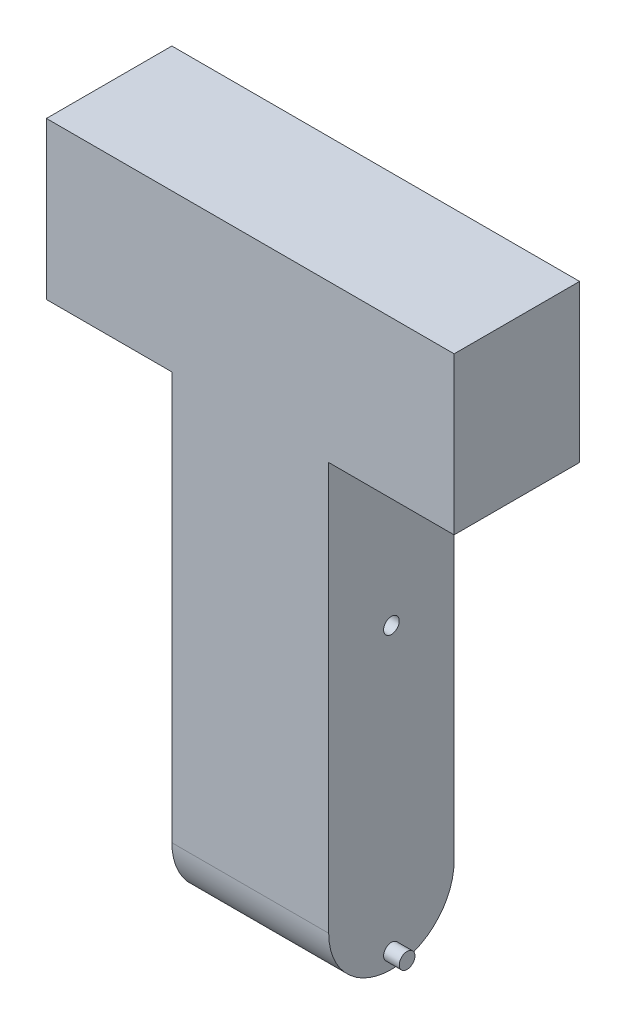
from build123d import *

# Parameters (mm, degrees)
SKETCH1_W                       = 254
SKETCH1_H                       = 1016
BOSS_EXTRUDE1_DEPTH             = 203.2
FILLET1_RADIUS                  = 101.6
FILLET1_LENGTH                  = 254
BOSS_EXTRUDE2_DEPTH             = 25.4
BOSS_EXTRUDE2_DEPTH_BACK        = 279.4
SKETCH2_R                       = 12.7
CUT_EXTRUDE1_DEPTH              = 195.834
CUT_EXTRUDE1_DEPTH_BACK         = 440.182
SKETCH4_R                       = 12.7
BOSS_EXTRUDE3_REACH             = 1060.604
SKETCH5_W                       = 660.4
SKETCH5_H                       = 254
BOSS_EXTRUDE3_DIRECTION_2_REACH = 1060.604


with BuildPart() as part:
    # Sketch1 → Boss-Extrude1 (new body)
    with BuildSketch(Plane.XY):
        with Locations((127, 508)):
            Rectangle(SKETCH1_W, SKETCH1_H)
    extrude(amount=BOSS_EXTRUDE1_DEPTH)

    # Fillet1: full round fillet: the end face becomes a half cylinder, R = half its width
    fillet1_face = Plane((127, 0, 101.6), x_dir=(1, 0, 0), z_dir=(0, -1, 0))  # on the end face: x along it, z out of the body
    fillet1_slab = fillet1_face.offset(-FILLET1_RADIUS / 2) * Box(FILLET1_LENGTH, 2 * FILLET1_RADIUS, FILLET1_RADIUS, mode=Mode.PRIVATE)  # the body's end, R deep
    fillet1_round = Plane((127, 101.6, 101.6), x_dir=(0, -1, 0), z_dir=(1, 0, 0)) * Cylinder(FILLET1_RADIUS, FILLET1_LENGTH, mode=Mode.PRIVATE)  # its axis R under the face
    add(fillet1_slab - fillet1_round, mode=Mode.SUBTRACT)

    # Sketch2 → Boss-Extrude2 (add, two sides: drawn at the far end of the back side and taken through both)
    with BuildSketch(Plane(origin=(254, 0, 0), x_dir=(0, 0, -1), z_dir=(1, 0, 0)).offset(-BOSS_EXTRUDE2_DEPTH_BACK)):
        with Locations((-101.6, 25.4)):
            Circle(SKETCH2_R)
    extrude(amount=BOSS_EXTRUDE2_DEPTH + BOSS_EXTRUDE2_DEPTH_BACK)

    # Sketch4 → Cut-Extrude1 (cut, two sides: drawn at the far end of the back side and taken through both)
    with BuildSketch(Plane(origin=(254, 0, 0), x_dir=(0, 0, -1), z_dir=(1, 0, 0)).offset(-CUT_EXTRUDE1_DEPTH_BACK)):
        with Locations(Location((-101.6, 482.6, 0), (0, 0, 180))):
            Circle(SKETCH4_R)
    extrude(amount=CUT_EXTRUDE1_DEPTH + CUT_EXTRUDE1_DEPTH_BACK, mode=Mode.SUBTRACT)

    # Boss-Extrude3: up to this face of the body (flat: up to its plane)
    boss_extrude3_end = Plane(part.part.faces().sort_by_distance((127, 558.8, 203.2))[0])
    # Sketch5 → Boss-Extrude3 (add, up to the picked face)
    with BuildSketch(Plane.XY.offset(101.6), mode=Mode.PRIVATE) as boss_extrude3_sk1:
        with Locations((127, 889)):
            Rectangle(SKETCH5_W, SKETCH5_H)
    boss_extrude3_tool1 = split(extrude(boss_extrude3_sk1.sketch, amount=BOSS_EXTRUDE3_REACH, mode=Mode.PRIVATE), bisect_by=boss_extrude3_end, keep=Keep.BOTH, mode=Mode.PRIVATE)
    add(boss_extrude3_tool1.solids().sort_by(Axis((127, 889, 101.6), (0, 0, 1)))[0])

    # Boss-Extrude3 direction 2: up to this face of the body (flat: up to its plane)
    boss_extrude3_direction_2_end = Plane(part.part.faces().sort_by_distance((127, 558.8, 0))[0])
    # Sketch5 → Boss-Extrude3 direction 2 (add, up to the picked face)
    with BuildSketch(Plane.XY.offset(101.6), mode=Mode.PRIVATE) as boss_extrude3_direction_2_sk1:
        with Locations((127, 889)):
            Rectangle(SKETCH5_W, SKETCH5_H)
    boss_extrude3_direction_2_tool1 = split(extrude(boss_extrude3_direction_2_sk1.sketch, amount=-BOSS_EXTRUDE3_DIRECTION_2_REACH, mode=Mode.PRIVATE), bisect_by=boss_extrude3_direction_2_end, keep=Keep.BOTH, mode=Mode.PRIVATE)
    add(boss_extrude3_direction_2_tool1.solids().sort_by(Axis((127, 889, 101.6), (0, 0, -1)))[0])


solid = part.part
